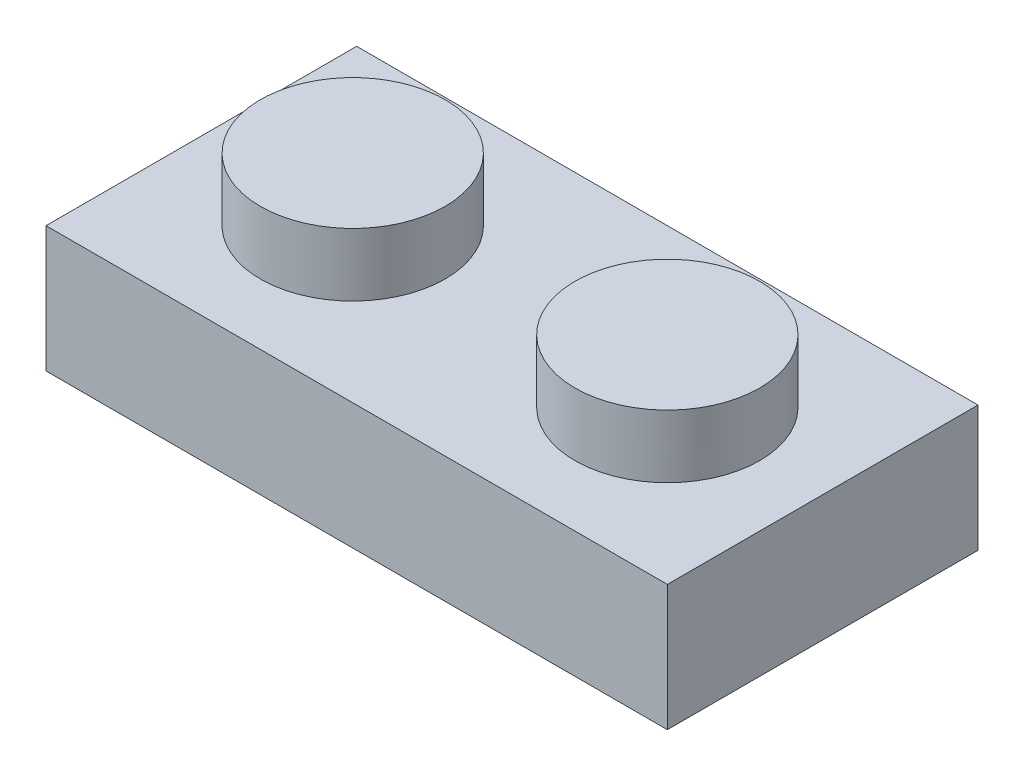
from build123d import *

# Parameters (mm, degrees)
MAINBASESKETCH_W        = 15.8
MAINBASESKETCH_H        = 3.2
MAINBASEEXTRUDE_DEPTH   = 7.9
STUDSSKETCH_R           = 2.35
STUDSEXTRUDE_DEPTH      = 1.6
STUDSPATTERN_COUNT      = 2
STUDSPATTERN_PITCH      = 8
STUDSPATTERN_COUNT_DIR2 = 2
STUDSPATTERN_PITCH_DIR2 = 8
MAINBASESHELL_T         = -1.2
LCUTBLUE_DEPTH          = 19.555463972
LCUTBLUE_DEPTH_BACK     = 19.555463972
CUTADDEDTOLCUT_DEPTH    = 2
MADESLIMCUTSKETCH_W     = 7.9
MADESLIMCUTSKETCH_H     = 7.9
MADESLIMCUT_DEPTH       = 19.897228453
MADESLIMFILLEXT_REACH   = 20.897
SKETCH33_W              = 5.500952983
SKETCH33_H              = 1.199047018
SLIMHOLEEXT_START       = -0.2
SLIMHOLESKETCH_R        = 1.25
SLIMHOLESKETCH_R_2      = 0.75
SLIMHOLEEXT_DEPTH       = 0.5


with BuildPart() as part:
    # MainBaseSketch → MainBaseExtrude (new, symmetric)
    with BuildSketch(Plane.XY):
        with Locations((8.581967213, 1.6)):
            Rectangle(MAINBASESKETCH_W, MAINBASESKETCH_H)
    extrude(amount=MAINBASEEXTRUDE_DEPTH, both=True)

    # StudsSketch → StudsExtrude (add)
    with BuildSketch(Plane(origin=(0, 3.2, 0), x_dir=(1, 0, 0), z_dir=(0, 1, 0))):
        with Locations((4.581967213, 4)):
            Circle(STUDSSKETCH_R)
    studsextrude = extrude(amount=STUDSEXTRUDE_DEPTH)

    # StudsPattern: StudsExtrude 2 × 2
    with Locations(*[(j * STUDSPATTERN_PITCH_DIR2, 0, i * STUDSPATTERN_PITCH) for i in range(STUDSPATTERN_COUNT) for j in range(STUDSPATTERN_COUNT_DIR2) if (i, j) != (0, 0)]):
        add(studsextrude)

    # MainBaseShell
    mainbaseshell_openings = [part.faces().sort_by_distance(p)[0] for p in [
        (8.581967213, 0, 0),
    ]]
    offset(amount=MAINBASESHELL_T, openings=mainbaseshell_openings, kind=Kind.INTERSECTION)

    # LCUTBlueSketch → LCutBlue (cut, two sides: drawn at the far end of the back side and taken through both)
    with BuildSketch(Plane(origin=(0, 3.2, 0), x_dir=(1, 0, 0), z_dir=(0, 1, 0)).offset(-LCUTBLUE_DEPTH_BACK)):
        Polygon((8.581967213, 53.229874044), (8.581967213, 7.9), (8.581967213, 0), (16.481967213, 0), (61.811841258, 0), (125.917963912, 64.106122654), (72.688089868, 117.335996699), align=None)
    extrude(amount=LCUTBLUE_DEPTH + LCUTBLUE_DEPTH_BACK, mode=Mode.SUBTRACT)

    # CutAddedtoLSketch → CutAddedToLCut (add)
    with BuildSketch(Plane.XZ):
        Polygon((7.382920196, -6.7), (8.581967213, -6.7), (8.581967213, 0), (15.281967213, 0), (15.281967213, 1.199047018), (7.382920196, 1.199047018), (7.382920196, 0), align=None)
    extrude(amount=-CUTADDEDTOLCUT_DEPTH)

    # MadeSlimCutSketch → MadeSlimCut (cut, through all)
    with BuildSketch(Plane.XZ):
        with Locations((4.631967213, -3.95)):
            Rectangle(MADESLIMCUTSKETCH_W, MADESLIMCUTSKETCH_H)
    extrude(amount=-MADESLIMCUT_DEPTH, mode=Mode.SUBTRACT)

    # Sketch33 → MadeSlimFillExt (add, up to next)
    with BuildSketch(Plane.XZ, mode=Mode.PRIVATE) as madeslimfillext_sk1:
        with Locations((4.632443704, 0.599523509)):
            Rectangle(SKETCH33_W, SKETCH33_H)
    madeslimfillext_tool1 = extrude(madeslimfillext_sk1.sketch, amount=-MADESLIMFILLEXT_REACH, mode=Mode.PRIVATE) - part.part
    add(madeslimfillext_tool1.solids().sort_by_distance((4.632444, 0, 0.599524))[0])

    # SlimHoleSketch → SlimHoleExt (add)
    with BuildSketch(Plane.XZ.offset(-2).offset(SLIMHOLEEXT_START)):
        with Locations((8.581967213, 4)):
            Circle(SLIMHOLESKETCH_R)
        with Locations((8.581967213, 4)):
            Circle(SLIMHOLESKETCH_R_2, mode=Mode.SUBTRACT)
    extrude(amount=SLIMHOLEEXT_DEPTH)


solid = part.part
